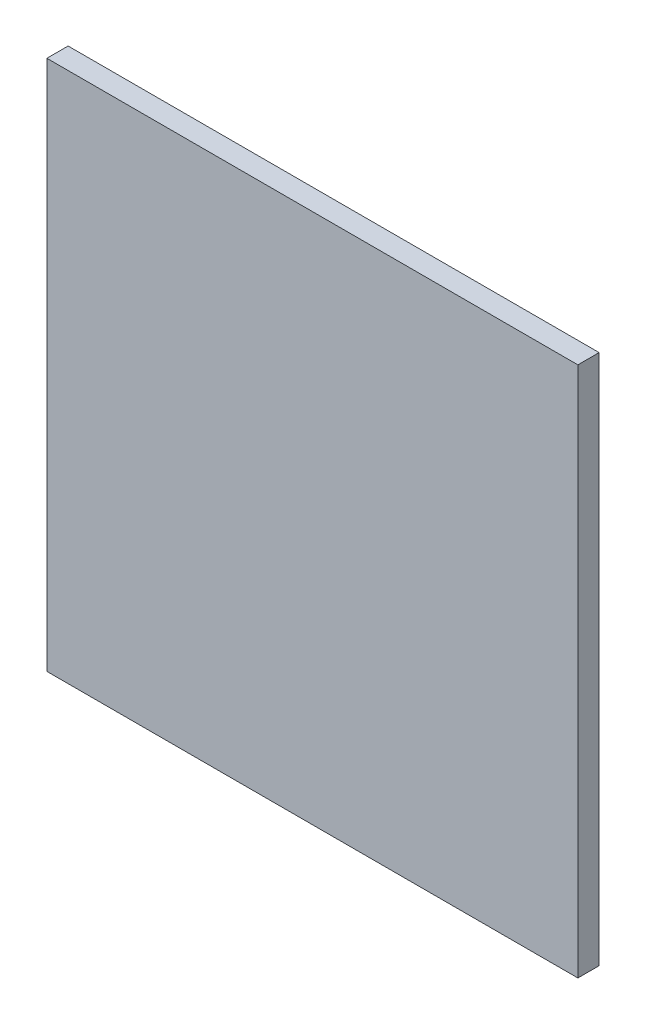
from build123d import *

# Parameters (mm, degrees)
SKETCH1_W           = 30
SKETCH1_H           = 30
BOSS_EXTRUDE1_DEPTH = 1.2


with BuildPart() as part:
    # Sketch1 → Boss-Extrude1 (new body)
    with BuildSketch(Plane.XY):
        Rectangle(SKETCH1_W, SKETCH1_H)
    extrude(amount=BOSS_EXTRUDE1_DEPTH)


solid = part.part
